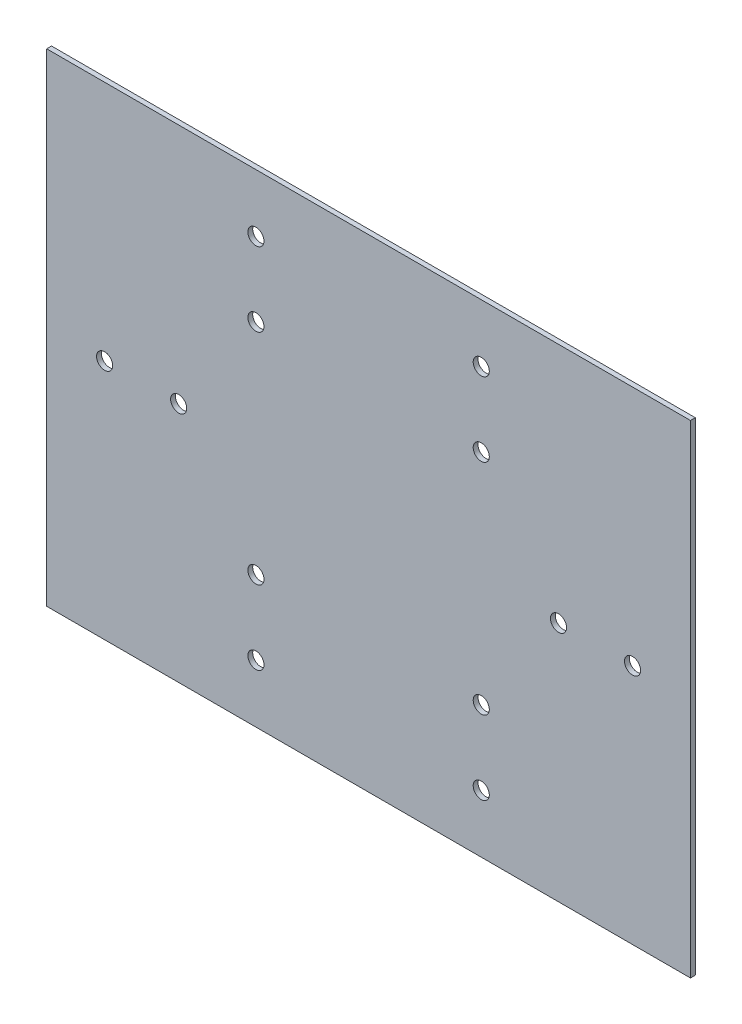
from build123d import *

# Parameters (mm, degrees)
SKETCH_1_W      = 200
SKETCH_1_H      = 150
SKETCH_1_R      = 2.5
EXTRUDE_1_DEPTH = 1.5


with BuildPart() as part:
    # 草图1 → 凸台-拉伸1 (new body)
    with BuildSketch(Plane.XY):
        Rectangle(SKETCH_1_W, SKETCH_1_H)
        with Locations((-82, 0)):
            Circle(SKETCH_1_R, mode=Mode.SUBTRACT)
        with Locations((-59, 0)):
            Circle(SKETCH_1_R, mode=Mode.SUBTRACT)
        with Locations(Location((59, 0, 0), (0, 0, 180))):
            Circle(SKETCH_1_R, mode=Mode.SUBTRACT)
        with Locations(Location((82, 0, 0), (0, 0, 180))):
            Circle(SKETCH_1_R, mode=Mode.SUBTRACT)
        with Locations((-35, -34)):
            Circle(SKETCH_1_R, mode=Mode.SUBTRACT)
        with Locations((-35, -57)):
            Circle(SKETCH_1_R, mode=Mode.SUBTRACT)
        with Locations(Location((35, -57, 0), (0, 0, 180))):
            Circle(SKETCH_1_R, mode=Mode.SUBTRACT)
        with Locations(Location((35, -34, 0), (0, 0, 180))):
            Circle(SKETCH_1_R, mode=Mode.SUBTRACT)
        with Locations((35, 57)):
            Circle(SKETCH_1_R, mode=Mode.SUBTRACT)
        with Locations((35, 34)):
            Circle(SKETCH_1_R, mode=Mode.SUBTRACT)
        with Locations(Location((-35, 57, 0), (0, 0, 180))):
            Circle(SKETCH_1_R, mode=Mode.SUBTRACT)
        with Locations(Location((-35, 34, 0), (0, 0, 180))):
            Circle(SKETCH_1_R, mode=Mode.SUBTRACT)
    extrude(amount=EXTRUDE_1_DEPTH)


solid = part.part
